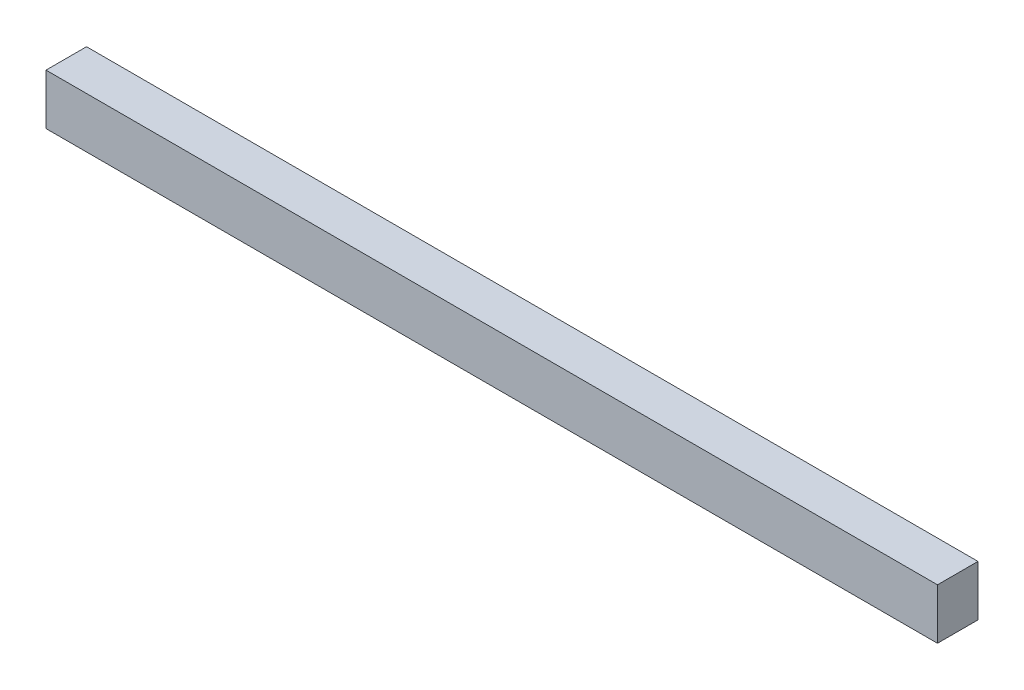
from build123d import *

# Parameters (mm, degrees)
SKETCH1_W             = 440
SKETCH1_H             = 20
BOSS_EXTRUDE1_DEPTH   = 25
M5_TAPPED_HOLE1_D     = 4.2
M5_TAPPED_HOLE1_DEPTH = 15
M5_TAPPED_HOLE1_TIP   = 1.2618073


with BuildPart() as part:
    # Sketch1 → Boss-Extrude1 (new body)
    with BuildSketch(Plane(origin=(0, 0, 0), x_dir=(1, 0, 0), z_dir=(0, 1, 0))):
        Rectangle(SKETCH1_W, SKETCH1_H)
    extrude(amount=BOSS_EXTRUDE1_DEPTH)

    # M5 Tapped Hole1
    with Locations(Plane(origin=(0, 0, -10), x_dir=(-1, 0, 0), z_dir=(0, 0, -1))):
        with Locations((0, 12.5), (60, 12.5), (120, 12.5), (180, 12.5), (-60, 12.5), (-120, 12.5), (-180, 12.5)):
            Hole(M5_TAPPED_HOLE1_D / 2, depth=M5_TAPPED_HOLE1_DEPTH)
            with Locations((0, 0, -(M5_TAPPED_HOLE1_DEPTH + M5_TAPPED_HOLE1_TIP / 2))):  # 118° drill point
                Cone(0, M5_TAPPED_HOLE1_D / 2, M5_TAPPED_HOLE1_TIP, mode=Mode.SUBTRACT)


solid = part.part
